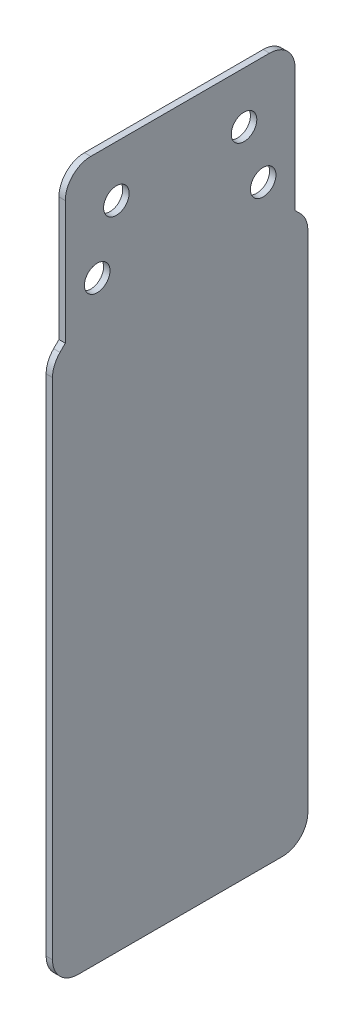
from build123d import *

# Parameters (mm, degrees)
SKETCH1_W                = 36
SKETCH1_H                = 110
BOSS_EXTRUDE1_DEPTH      = 1
F_4_0_4_DIAMETER_HOLE2_D = 4
F_4_0_4_DIAMETER_HOLE3_D = 4
BOSS_EXTRUDE2_DEPTH      = 1
FILLET1_R                = 4
FILLET2_R                = 4


with BuildPart() as part:
    # Sketch1 → Boss-Extrude1 (new body)
    with BuildSketch(Plane(origin=(0, 0, 0), x_dir=(0, 0, -1), z_dir=(1, 0, 0))):
        with Locations((0, -55)):
            Rectangle(SKETCH1_W, SKETCH1_H)
    extrude(amount=BOSS_EXTRUDE1_DEPTH)

    # Ø4.0 (4) Diameter Hole2 (through all)
    with Locations(Plane.ZY):
        with Locations((-10, -8), (10, -8)):
            Hole(F_4_0_4_DIAMETER_HOLE2_D / 2)

    # Ø4.0 (4) Diameter Hole3 (through all)
    with Locations(Plane.ZY):
        with Locations((-13, -17), (13, -17)):
            Hole(F_4_0_4_DIAMETER_HOLE3_D / 2)

    # Sketch9 → Boss-Extrude2 (add)
    with BuildSketch(Plane.ZY):
        Polygon((18, -23.35), (20, -25.35), (20, -110), (18, -110), align=None)
        Polygon((-18, -23.35), (-20, -25.35), (-20, -110), (-18, -110), align=None)
    extrude(amount=-BOSS_EXTRUDE2_DEPTH)

    # Fillet1
    fillet1_edges = [part.edges().sort_by_distance(p)[0] for p in [
        (0.5, 0, 18),
        (0.5, 0, -18),
    ]]
    fillet(fillet1_edges, radius=FILLET1_R)

    # Fillet2
    fillet2_edges = [part.edges().sort_by_distance(p)[0] for p in [
        (0.5, -25.35, 20),
        (0.5, -110, 20),
        (0.5, -110, -20),
        (0.5, -25.35, -20),
    ]]
    fillet(fillet2_edges, radius=FILLET2_R)


solid = part.part
